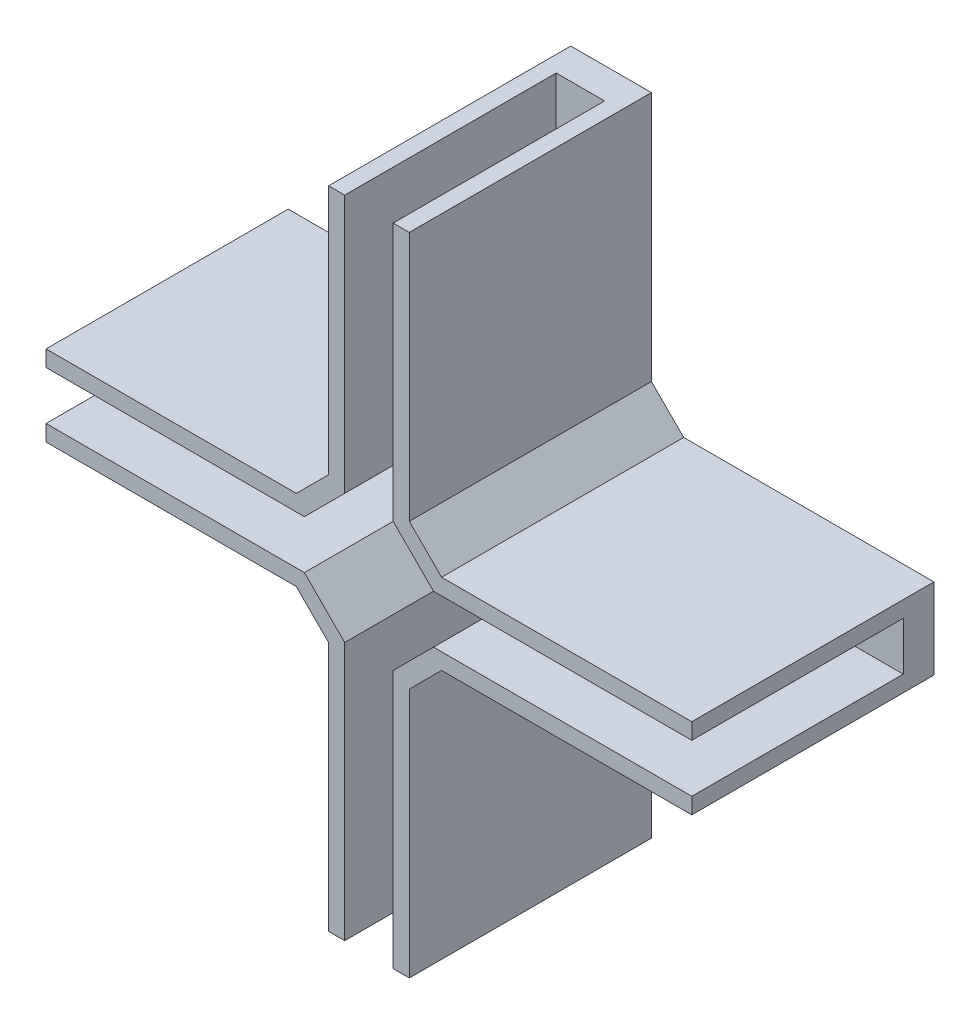
from build123d import *

# Parameters (mm, degrees)
RESSALTO_EXTRUS_O1_DEPTH = 15
ESBO_O2_W                = 40
ESBO_O2_H                = 3
ESBO_O2_W_2              = 3
ESBO_O2_H_2              = 40
CORTE_EXTRUS_O1_DEPTH    = 13.1
CHANFRO2_SIZE            = 2.5


with BuildPart() as part:
    # Esboço1 → Ressalto-extrusão1 (new body)
    with BuildSketch(Plane.XY):
        Polygon((2.5, 4.5), (2.5, 20), (-2.5, 20), (-2.5, 4.5), (-4.5, 2.5), (-20, 2.5), (-20, -2.5), (-4.5, -2.5), (-2.5, -4.5), (-2.5, -20), (2.5, -20), (2.5, -4.5), (4.5, -2.5), (20, -2.5), (20, 2.5), (4.5, 2.5), align=None)
    extrude(amount=RESSALTO_EXTRUS_O1_DEPTH)

    # Esboço2 → Corte-extrusão1 (cut)
    with BuildSketch(Plane.XY.offset(15)):
        Rectangle(ESBO_O2_W, ESBO_O2_H)
        Rectangle(ESBO_O2_W_2, ESBO_O2_H_2)
    extrude(amount=-CORTE_EXTRUS_O1_DEPTH, mode=Mode.SUBTRACT)

    # Chanfro2
    chanfro2_edges = [part.edges().sort_by_distance(p)[0] for p in [
        (-1.5, -1.5, 8.45),
        (1.5, 1.5, 8.45),
        (-1.5, 1.5, 8.45),
        (1.5, -1.5, 8.45),
    ]]
    chamfer(chanfro2_edges, length=CHANFRO2_SIZE)


solid = part.part
